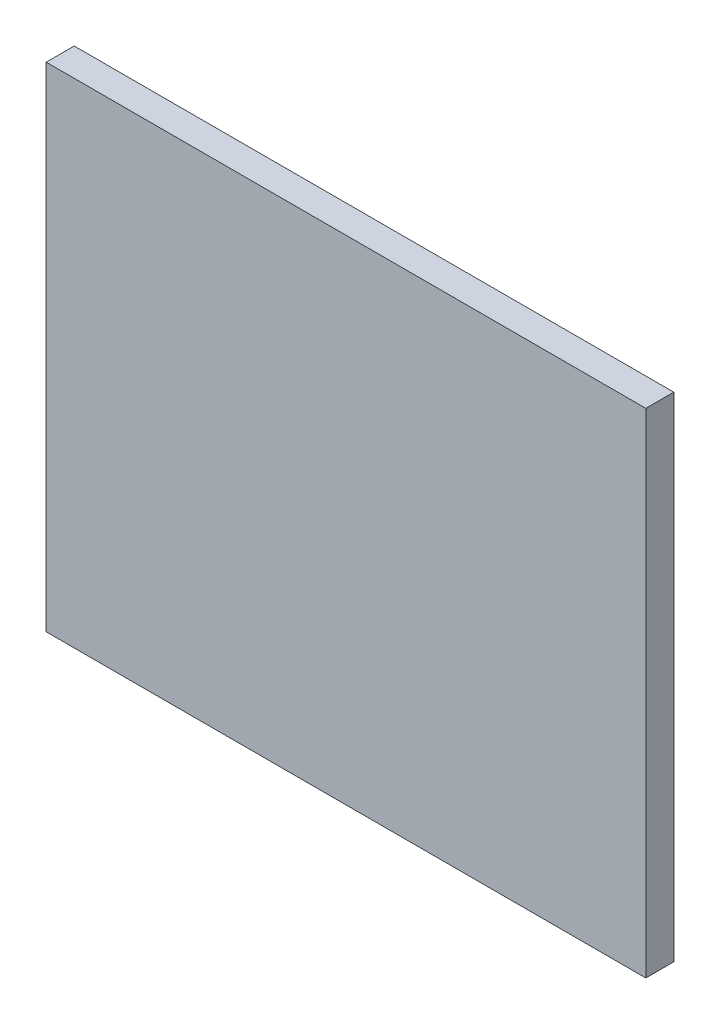
from build123d import *

# Parameters (mm, degrees)
SKETCH1_W           = 1499.72
SKETCH1_H           = 1234.02
BOSS_EXTRUDE1_DEPTH = 70


with BuildPart() as part:
    # Sketch1 → Boss-Extrude1 (new body)
    with BuildSketch(Plane.XY):
        Rectangle(SKETCH1_W, SKETCH1_H)
    extrude(amount=BOSS_EXTRUDE1_DEPTH)


solid = part.part
